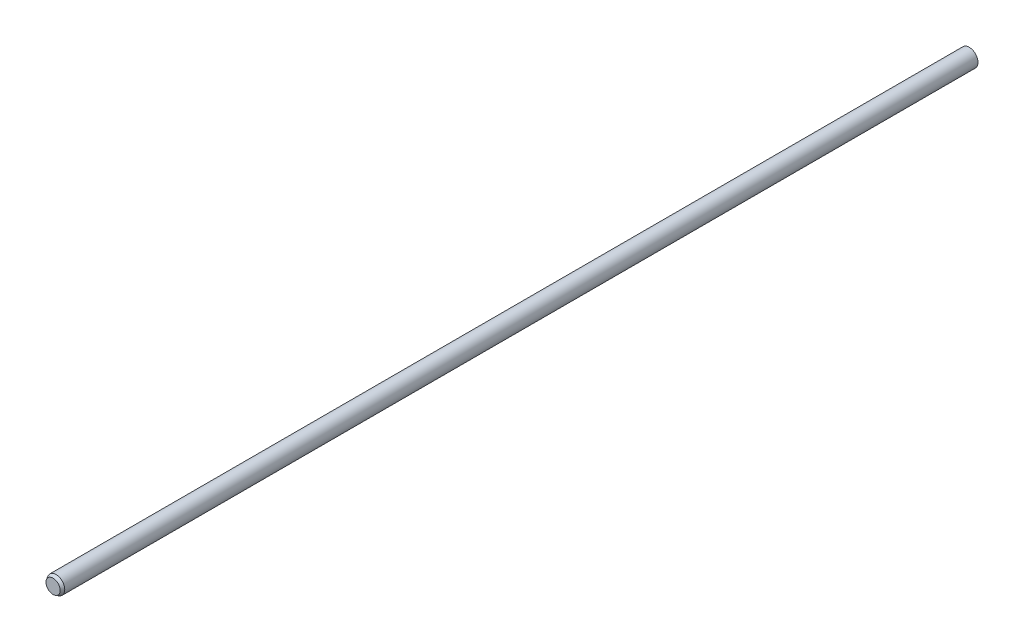
from build123d import *
from OCP.BRepFilletAPI import BRepFilletAPI_MakeChamfer

# Parameters (mm, degrees)
SKETCH1_R           = 3
BOSS_EXTRUDE1_DEPTH = 314
CHAMFER1_SIZE       = 1
CHAMFER1_SIZE2      = 0.577350269


with BuildPart() as part:
    # Sketch1 → Boss-Extrude1 (new body)
    with BuildSketch(Plane.XY):
        Circle(SKETCH1_R)
    extrude(amount=BOSS_EXTRUDE1_DEPTH)

    # Chamfer1: one chamfer whose edges measure the first distance from different faces: ONE call of the kernel's chamfer builder (chamfer() names one face for all edges)
    chamfer1_edges_1 = [part.edges().sort_by_distance(p)[0] for p in [
        (-3, 0, 0),
    ]]
    chamfer1_side_1 = [part.faces().sort_by_distance(p)[0] for p in [
        (0, 0, 0),
    ]]
    chamfer1_edges_2 = [part.edges().sort_by_distance(p)[0] for p in [
        (-3, 0, 314),
    ]]
    chamfer1_side_2 = [part.faces().sort_by_distance(p)[0] for p in [
        (-3, 0, 157),
    ]]
    chamfer1 = BRepFilletAPI_MakeChamfer(part.part.solid().wrapped)
    for e in chamfer1_edges_1:
        chamfer1.Add(CHAMFER1_SIZE, CHAMFER1_SIZE2, e.wrapped, chamfer1_side_1[0].wrapped)  # the first distance lies on this face
    for e in chamfer1_edges_2:
        chamfer1.Add(CHAMFER1_SIZE, CHAMFER1_SIZE2, e.wrapped, chamfer1_side_2[0].wrapped)  # the first distance lies on this face
    add(Compound.cast(chamfer1.Shape()), mode=Mode.REPLACE)


solid = part.part
